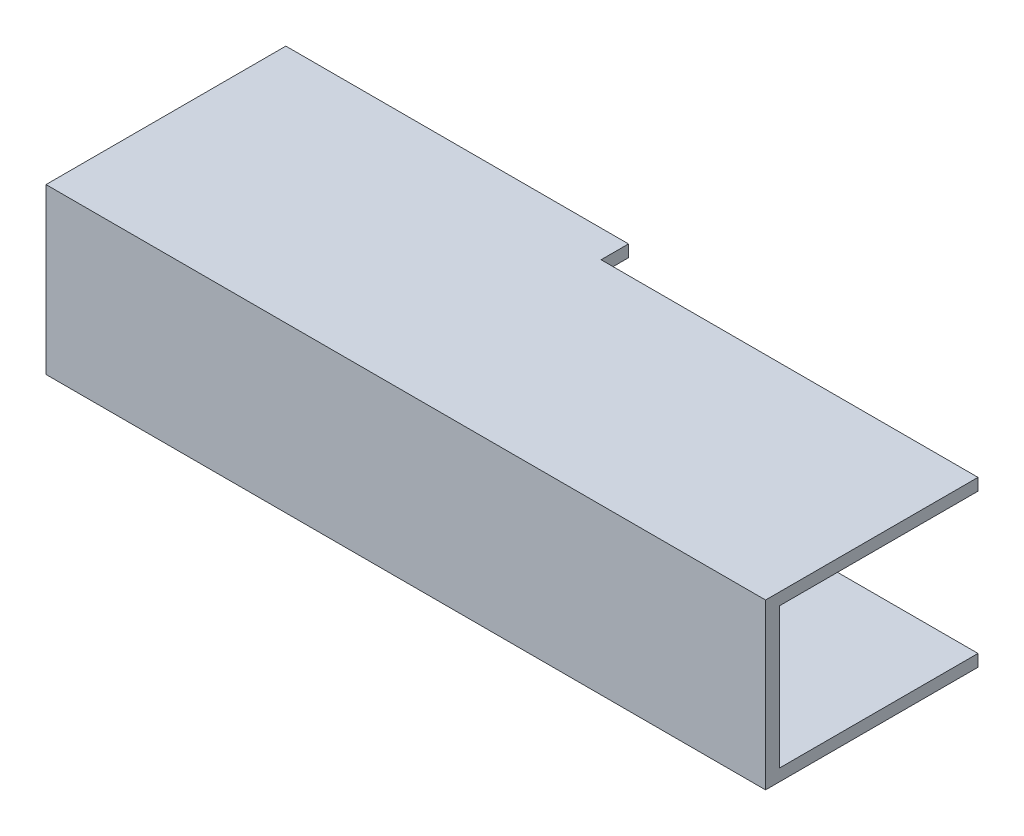
from build123d import *

# Parameters (mm, degrees)
SKETCH_1_W          = 105
SKETCH_1_H          = 24
EXTRUDE_1_DEPTH     = 35
SKETCH_2_W          = 33
SKETCH_2_H          = 20.5
CUT_EXTRUDE_1_DEPTH = 50
CUT_EXTRUDE_2_DEPTH = 55


with BuildPart() as part:
    # 草图1 → 凸台-拉伸1 (new body)
    with BuildSketch(Plane.XY):
        with Locations((-16.041666667, 6.034090909)):
            Rectangle(SKETCH_1_W, SKETCH_1_H)
    extrude(amount=EXTRUDE_1_DEPTH)

    # 草图2 → 切除-拉伸1 (cut)
    with BuildSketch(Plane.ZY.offset(68.541666667)):
        with Locations((16.5, 6.034090909)):
            Rectangle(SKETCH_2_W, SKETCH_2_H)
    extrude(amount=-CUT_EXTRUDE_1_DEPTH, mode=Mode.SUBTRACT)

    # 草图3 → 切除-拉伸2 (cut)
    with BuildSketch(Plane(origin=(36.458333333, 0, 0), x_dir=(0, 0, -1), z_dir=(1, 0, 0))):
        Polygon((-33, 16.284090909), (-4, 16.284090909), (-4, 18.034090909), (0, 18.034090909), (0, -5.965909091), (-4, -5.965909091), (-4, -4.215909091), (-33, -4.215909091), align=None)
    extrude(amount=-CUT_EXTRUDE_2_DEPTH, mode=Mode.SUBTRACT)


solid = part.part
